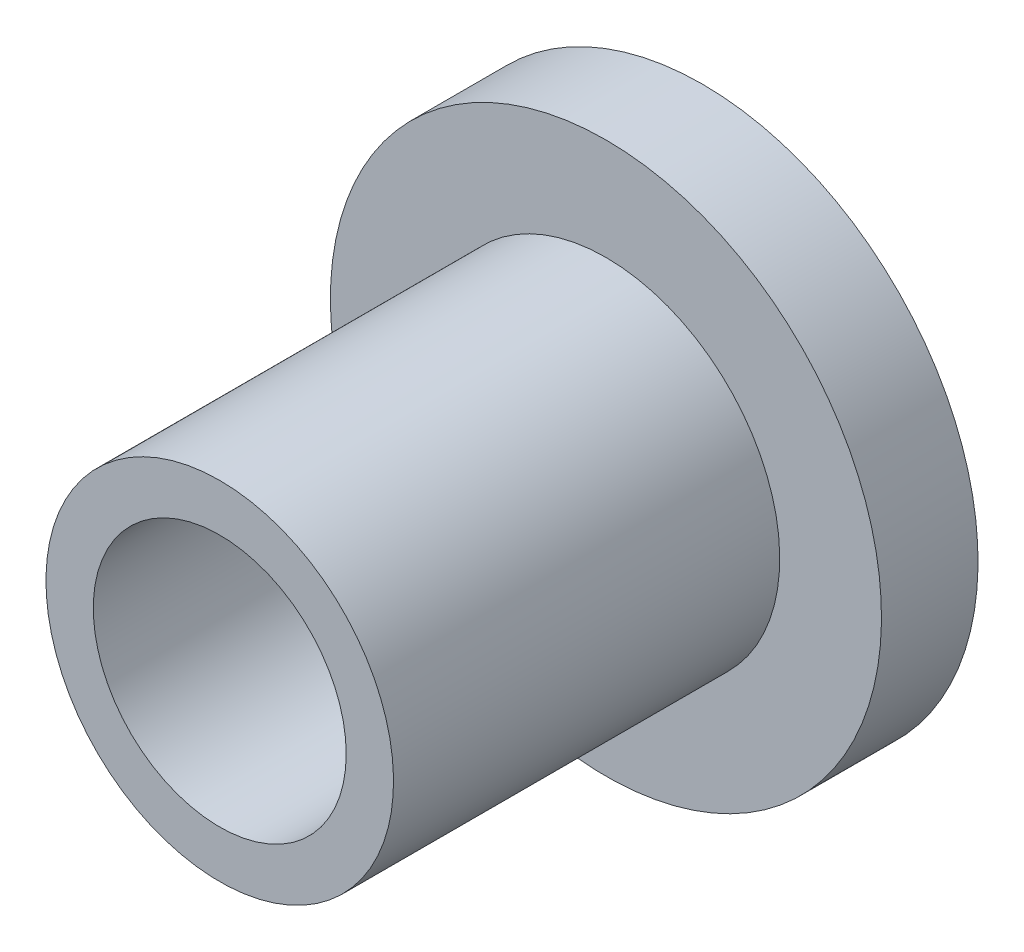
from build123d import *

# Parameters (mm, degrees)
SKETCH1_R           = 8.999999998
BOSS_EXTRUDE1_DEPTH = 20
SKETCH2_R           = 14.270327874
BOSS_EXTRUDE2_DEPTH = 5
SKETCH3_R           = 6.549662412
CUT_EXTRUDE1_DEPTH  = 18


with BuildPart() as part:
    # Sketch1 → Boss-Extrude1 (new body)
    with BuildSketch(Plane(origin=(0, 0, 1384.443253532), x_dir=(-1, 0, 0), z_dir=(0, 0, -1))):
        with Locations(Location((-588.451811663, 952.777089149, 0), (0, 0, 90))):
            Circle(SKETCH1_R)
    extrude(amount=-BOSS_EXTRUDE1_DEPTH)

    # Sketch2 → Boss-Extrude2 (add)
    with BuildSketch(Plane(origin=(0, 0, 1384.443253532), x_dir=(-1, 0, 0), z_dir=(0, 0, -1))):
        with Locations(Location((-588.451811663, 952.777089149, 0), (0, 0, 90))):
            Circle(SKETCH2_R)
    extrude(amount=BOSS_EXTRUDE2_DEPTH)

    # Sketch3 → Cut-Extrude1 (cut)
    with BuildSketch(Plane.XY.offset(1404.443253532)):
        with Locations((588.451811663, 952.777089149)):
            Circle(SKETCH3_R)
    extrude(amount=-CUT_EXTRUDE1_DEPTH, mode=Mode.SUBTRACT)


solid = part.part
